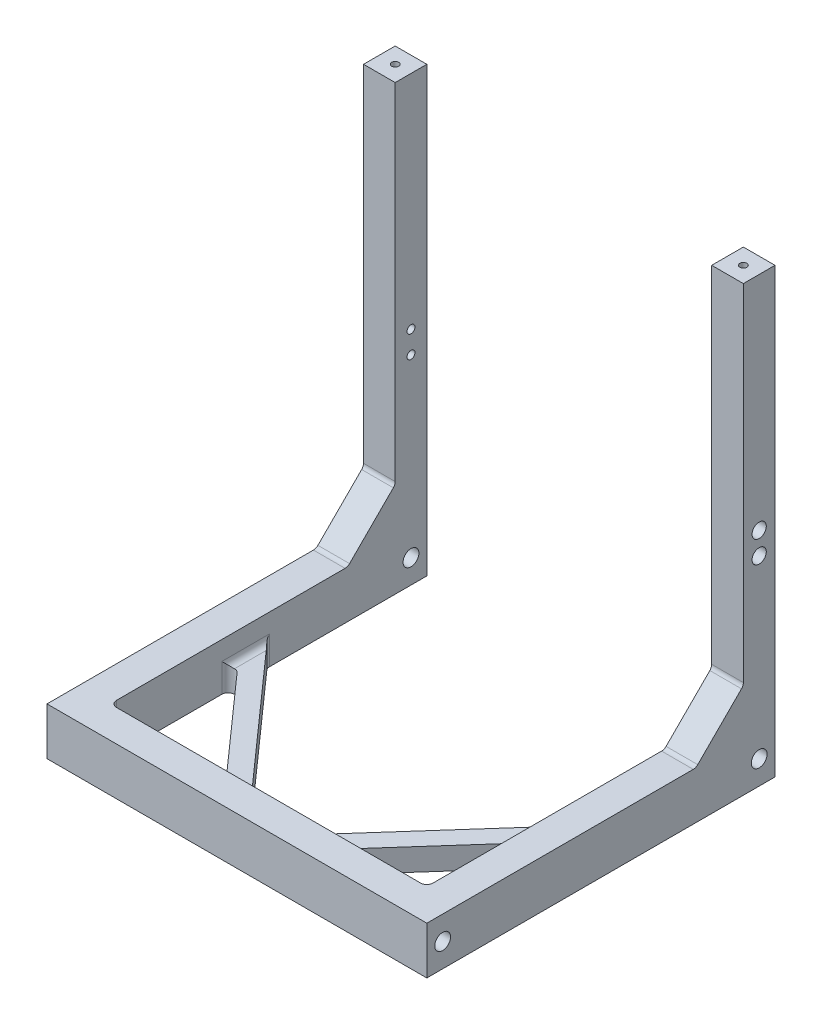
from build123d import *

# Parameters (mm, degrees)
BOSS_EXTRUDE1_DEPTH   = 19.05
SKETCH2_W             = 12.7
SKETCH2_H             = 158.75
BOSS_EXTRUDE2_DEPTH   = 12.7
BOSS_EXTRUDE2_2_DEPTH = 12.7
BOSS_EXTRUDE3_DEPTH   = 12.7
BOSS_EXTRUDE4_DEPTH   = 12.7
SKETCH5_R             = 1.5875
CUT_EXTRUDE1_DEPTH    = 273.680564031
SKETCH6_R             = 2.8575
CUT_EXTRUDE2_DEPTH    = 5.08
BOSS_EXTRUDE5_DEPTH   = 8.89
SKETCH8_R             = 1.397
CUT_EXTRUDE3_DEPTH    = 12.7
FILLET1_R             = 2.54
SKETCH9_R             = 3.175
CUT_EXTRUDE4_DEPTH    = 273.680564031


with BuildPart() as part:
    # Sketch1 → Boss-Extrude1 (new body)
    with BuildSketch(Plane(origin=(0, 0, 0), x_dir=(1, 0, 0), z_dir=(0, 1, 0))):
        Polygon((-76.2, 139.7), (-76.2, 0), (76.2, 0), (76.2, 139.7), (63.5, 139.7), (63.5, 12.7), (-63.5, 12.7), (-63.5, 139.7), align=None)
    extrude(amount=BOSS_EXTRUDE1_DEPTH)



with BuildPart() as body_2:
    # Sketch2 → Boss-Extrude2 (new body)
    with BuildSketch(Plane(origin=(0, 0, -139.7), x_dir=(-1, 0, 0), z_dir=(0, 0, -1))):
        with Locations((-69.85, 98.425)):
            Rectangle(SKETCH2_W, SKETCH2_H)
    extrude(amount=-BOSS_EXTRUDE2_DEPTH)


with BuildPart() as body_3:
    # Sketch2 → Boss-Extrude2 2 (new body)
    with BuildSketch(Plane(origin=(0, 0, -139.7), x_dir=(-1, 0, 0), z_dir=(0, 0, -1))):
        with Locations((69.85, 98.425)):
            Rectangle(SKETCH2_W, SKETCH2_H)
    extrude(amount=-BOSS_EXTRUDE2_2_DEPTH)


with BuildPart() as part_1:
    add(part.part)

    add(body_2.part)  # Boss-Extrude3 merges body 2
    # Sketch3 → Boss-Extrude3 (add)
    with BuildSketch(Plane(origin=(76.2, 0, 0), x_dir=(0, 0, -1), z_dir=(1, 0, 0))):
        Polygon((127, 38.1), (107.95, 19.05), (127, 19.05), align=None)
    extrude(amount=-BOSS_EXTRUDE3_DEPTH)


    add(body_3.part)  # Boss-Extrude4 merges body 3
    # Sketch4 → Boss-Extrude4 (add)
    with BuildSketch(Plane.ZY.offset(76.2)):
        Polygon((-127, 38.1), (-107.95, 19.05), (-127, 19.05), align=None)
    extrude(amount=-BOSS_EXTRUDE4_DEPTH)

    # Sketch5 → Cut-Extrude1 (cut, through all)
    with BuildSketch(Plane(origin=(76.2, 0, 0), x_dir=(0, 0, -1), z_dir=(1, 0, 0))):
        with Locations((133.35, 88.9)):
            Circle(SKETCH5_R)
        with Locations((133.35, 80.01)):
            Circle(SKETCH5_R)
    extrude(amount=-CUT_EXTRUDE1_DEPTH, mode=Mode.SUBTRACT)

    # Sketch6 → Cut-Extrude2 (cut)
    with BuildSketch(Plane(origin=(76.2, 0, 0), x_dir=(0, 0, -1), z_dir=(1, 0, 0))):
        with Locations((133.35, 88.9)):
            Circle(SKETCH6_R)
        with Locations(Location((133.35, 80.01, 0), (0, 0, 180))):
            Circle(SKETCH6_R)
    cut_extrude2 = extrude(amount=-CUT_EXTRUDE2_DEPTH, mode=Mode.SUBTRACT)

    # Mirror2: Cut-Extrude2 across plane
    add(cut_extrude2.mirror(Plane(origin=(0, 0, 0), x_dir=(0, 0, 1), z_dir=(1, 0, 0))), mode=Mode.SUBTRACT)

    # Sketch7 → Boss-Extrude5 (add)
    with BuildSketch(Plane.XZ):
        Polygon((-17.797608372, -12.7), (-63.5, -64.115190582), (-63.5, -75.584809418), (-7.602391628, -12.7), align=None)
        Polygon((7.602391628, -12.7), (17.797608372, -12.7), (63.5, -64.115190582), (63.5, -75.584809418), align=None)
    extrude(amount=-BOSS_EXTRUDE5_DEPTH)

    # Sketch8 → Cut-Extrude3 (cut)
    with BuildSketch(Plane(origin=(0, 177.8, 0), x_dir=(1, 0, 0), z_dir=(0, 1, 0))):
        with Locations(Location((69.85, 133.35, 0), (0, 0, 270))):
            Circle(SKETCH8_R)
    cut_extrude3 = extrude(amount=-CUT_EXTRUDE3_DEPTH, mode=Mode.SUBTRACT)

    # Mirror3: Cut-Extrude3 across plane
    add(cut_extrude3.mirror(Plane(origin=(0, 0, 0), x_dir=(0, 0, 1), z_dir=(1, 0, 0))), mode=Mode.SUBTRACT)

    # Fillet1
    fillet1_edges = [part_1.edges().sort_by_distance(p)[0] for p in [
        (63.5, 4.445, -75.584809418),
        (12.7, 8.89, -12.7),
        (7.602391628, 4.445, -12.7),
        (17.797608372, 4.445, -12.7),
        (63.5, 8.89, -69.85),
        (63.5, 4.445, -64.115190582),
        (-69.85, 19.05, -107.95),
        (-69.85, 38.1, -127),
        (63.5, 9.525, -12.7),
        (-63.5, 9.525, -12.7),
        (69.85, 19.05, -107.95),
        (69.85, 38.1, -127),
        (-12.7, 8.89, -12.7),
        (-17.797608372, 4.445, -12.7),
        (-7.602391628, 4.445, -12.7),
        (-63.5, 8.89, -69.85),
        (-63.5, 4.445, -75.584809418),
        (-63.5, 4.445, -64.115190582),
    ]]
    fillet(fillet1_edges, radius=FILLET1_R)

    # Sketch9 → Cut-Extrude4 (cut, through all)
    with BuildSketch(Plane(origin=(76.2, 0, 0), x_dir=(0, 0, -1), z_dir=(1, 0, 0))):
        with Locations((6.35, 9.525)):
            Circle(SKETCH9_R)
        with Locations((133.35, 9.525)):
            Circle(SKETCH9_R)
    extrude(amount=-CUT_EXTRUDE4_DEPTH, mode=Mode.SUBTRACT)


solid = part_1.part
